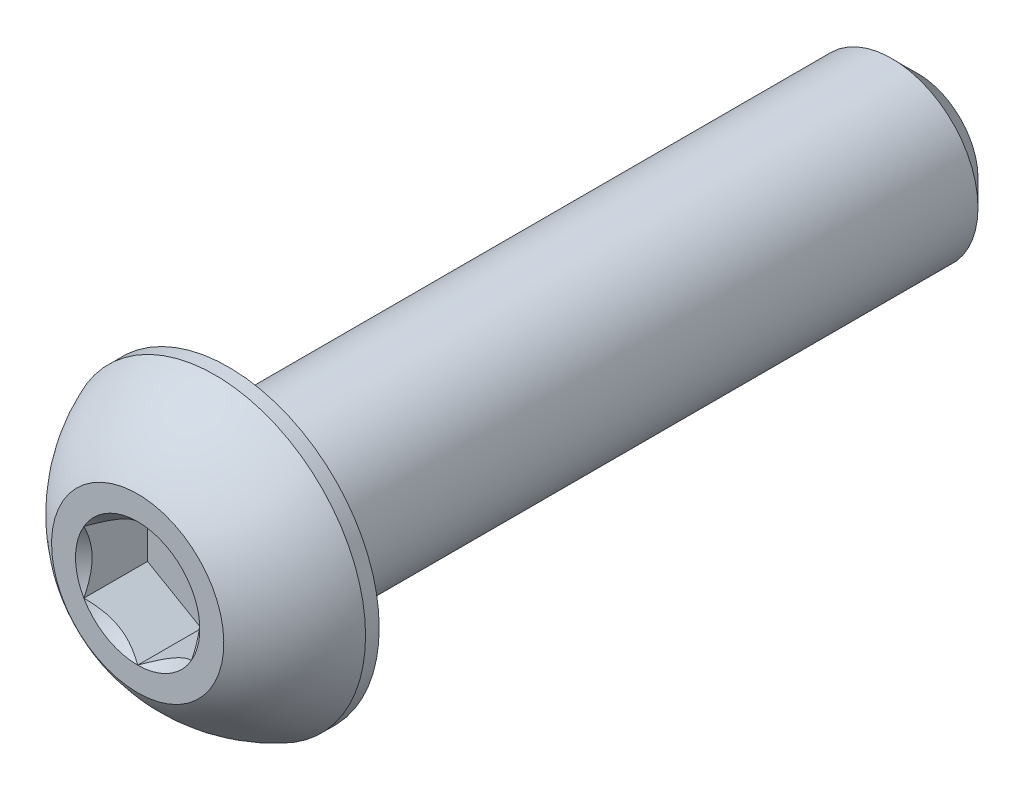
from build123d import *

# Parameters (mm, degrees)
SKETCH1_W          = 25.4
SKETCH1_H          = 3.175
CHAMFER1_SIZE      = 0.9525
CUT_EXTRUDE2_DEPTH = 2.34696


with BuildPart() as part:
    # Sketch1 → Revolve1 (revolve)
    with BuildSketch(Plane(origin=(0, 0, 0), x_dir=(0, 0, -1), z_dir=(1, 0, 0))):
        with Locations((16.0528, 1.5875)):
            Rectangle(SKETCH1_W, SKETCH1_H)
    revolve(axis=Axis((0, 0, -28.7528), (0, 0, 1)))

    # Chamfer1
    chamfer1_edges = [part.edges().sort_by_distance(p)[0] for p in [
        (0, -3.175, -28.7528),
    ]]
    chamfer(chamfer1_edges, length=CHAMFER1_SIZE)

    # Sketch7 → Revolve2 (revolve)
    with BuildSketch(Plane(origin=(0, 0, 0), x_dir=(0, 0, -1), z_dir=(1, 0, 0))):
        with BuildLine():
            Line((2.84988, 5.5499), (3.3528, 5.5499))
            Line((3.3528, 5.5499), (3.3528, 0))
            Line((3.3528, 0), (0, 0))
            Line((0, 0), (0, 3.175))
            ThreePointArc((0, 3.175), (1.235921075, 4.58927271), (2.84988, 5.5499))
        make_face()
    revolve(axis=Axis((0, 0, 0), (0, 0, -1)))

    # Sketch5 → Cut-Extrude2 (cut)
    with BuildSketch(Plane.XY):
        Polygon((1.984375, -1.14567944), (1.984375, 1.14567944), (0, 2.291358881), (-1.984375, 1.14567944), (-1.984375, -1.14567944), (0, -2.291358881), align=None)
    extrude(amount=-CUT_EXTRUDE2_DEPTH, mode=Mode.SUBTRACT)

    # Cut-Extrude3 cone 1 section (through the dimple's axis) → Cut-Extrude3 (revolve, cut)
    with BuildSketch(Plane(origin=(0, 0, 0), x_dir=(0, -1, 0), z_dir=(1, 0, 0))):
        Polygon((0, 0), (2.291358881, 0), (0, 2.291358881), align=None)
    revolve(axis=Axis((0, 0, 0), (0, 0, -1)), mode=Mode.SUBTRACT)


solid = part.part
